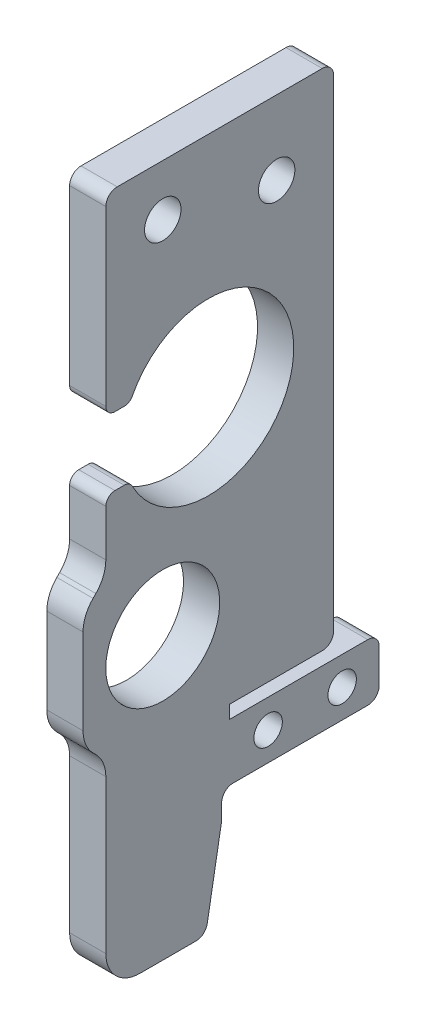
from build123d import *

# Parameters (mm, degrees)
SKETCH1_R           = 5
SKETCH1_R_2         = 1.6
SKETCH1_R_3         = 1.25
BOSS_EXTRUDE1_DEPTH = 3.18
CHAMFER1_SIZE       = 8
CHAMFER1_SIZE2      = 1.410615846
FILLET1_R           = 1
FILLET2_R           = 3
CUT_EXTRUDE5_DEPTH  = 66.452032054
FILLET3_R           = 0.8


with BuildPart() as part:
    # Sketch1 → Boss-Extrude1 (new body)
    with BuildSketch(Plane(origin=(0, 0, 0), x_dir=(0, 0, -1), z_dir=(1, 0, 0))):
        Polygon((0, 0), (0, 17.7), (-2, 19.7), (-2, 29.7), (0, 31.7), (0, 60.81), (20, 60.81), (20, 16.53), (10.85, 16.53), (10.85, 15.38), (24, 15.38), (24, 10.38), (10.17, 10.38), (10.17, 0), align=None)
        with Locations(Location((5, 24.7, 0), (0, 0, 180))):
            Circle(SKETCH1_R, mode=Mode.SUBTRACT)
        with Locations(Location((5, 56.31, 0), (0, 0, 180))):
            Circle(SKETCH1_R_2, mode=Mode.SUBTRACT)
        with Locations(Location((15, 54.31, 0), (0, 0, 180))):
            Circle(SKETCH1_R_2, mode=Mode.SUBTRACT)
        with Locations(Location((20.75, 12.88, 0), (0, 0, 180))):
            Circle(SKETCH1_R_3, mode=Mode.SUBTRACT)
        with Locations(Location((14.25, 12.88, 0), (0, 0, 180))):
            Circle(SKETCH1_R_3, mode=Mode.SUBTRACT)
    extrude(amount=BOSS_EXTRUDE1_DEPTH)

    # Chamfer1
    chamfer1_edges = [part.edges().sort_by_distance(p)[0] for p in [
        (1.59, 0, -10.17),
    ]]
    chamfer1_side = [part.faces().sort_by_distance(p)[0] for p in [
        (1.59, 5.19, -10.17),
    ]]
    chamfer(chamfer1_edges, length=CHAMFER1_SIZE, length2=CHAMFER1_SIZE2, reference=chamfer1_side[0])

    # Fillet1
    fillet1_edges = [part.edges().sort_by_distance(p)[0] for p in [
        (1.59, 60.81, 0),
        (1.59, 60.81, -20),
        (1.59, 16.53, -20),
        (1.59, 15.38, -24),
        (1.59, 10.38, -24),
        (1.59, 10.38, -10.17),
        (1.59, 0, -8.759384154),
    ]]
    fillet(fillet1_edges, radius=FILLET1_R)

    # Fillet2
    fillet2_edges = [part.edges().sort_by_distance(p)[0] for p in [
        (1.59, 0, 0),
        (1.59, 17.7, 0),
        (1.59, 19.7, 2),
        (1.59, 29.7, 2),
        (1.59, 31.7, 0),
    ]]
    fillet(fillet2_edges, radius=FILLET2_R)

    # Sketch8 → Cut-Extrude5 (cut, through all)
    with BuildSketch(Plane(origin=(3.18, 0, 0), x_dir=(0, 0, -1), z_dir=(1, 0, 0))):
        with BuildLine():
            Line((0, 43.810865899), (2.126136458, 43.810865899))
            ThreePointArc((2.126136458, 43.810865899), (16.5, 40.810865899), (2.126136458, 37.810865899))
            Line((2.126136458, 37.810865899), (0, 37.810865899))
            Line((0, 37.810865899), (0, 43.810865899))
        make_face()
    extrude(amount=-CUT_EXTRUDE5_DEPTH, mode=Mode.SUBTRACT)

    # Fillet3
    fillet3_edges = [part.edges().sort_by_distance(p)[0] for p in [
        (1.59, 37.810865899, 0),
        (1.59, 43.810865899, 0),
        (1.59, 43.810865899, -2.126136458),
        (1.59, 37.810865899, -2.126136458),
    ]]
    fillet(fillet3_edges, radius=FILLET3_R)


solid = part.part
